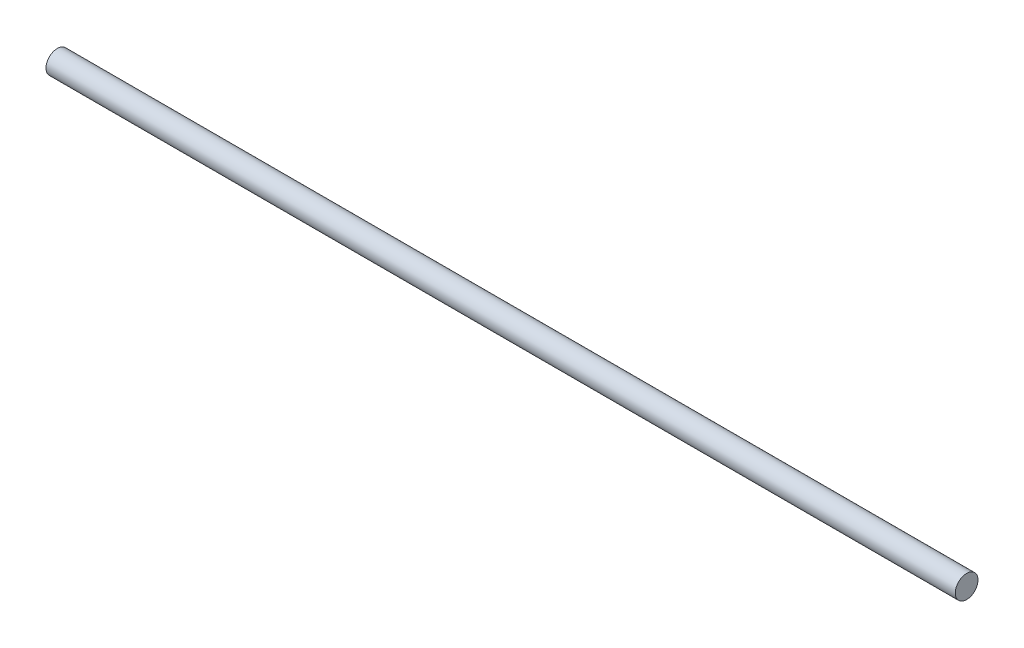
from build123d import *

# Parameters (mm, degrees)
SKETCH1_R           = 12.500097667
BOSS_EXTRUDE1_DEPTH = 500


with BuildPart() as part:
    # Sketch1 → Boss-Extrude1 (new, symmetric)
    with BuildSketch(Plane(origin=(0, 0, 0), x_dir=(0, 0, -1), z_dir=(1, 0, 0))):
        Circle(SKETCH1_R)
    extrude(amount=BOSS_EXTRUDE1_DEPTH, both=True)


solid = part.part
